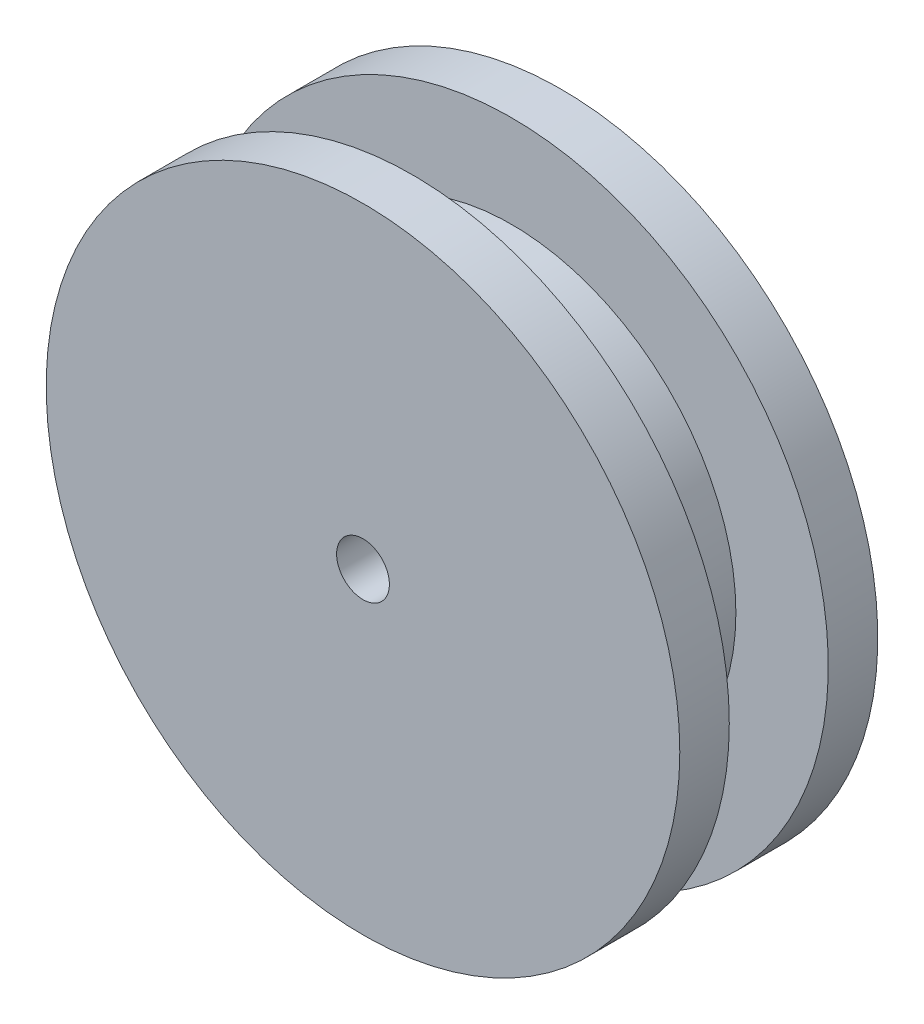
from build123d import *

# Parameters (mm, degrees)
SKETCH1_R           = 34
BOSS_EXTRUDE1_DEPTH = 15
SKETCH2_R           = 48
BOSS_EXTRUDE2_DEPTH = 7.5
BOSS_EXTRUDE3_START = 7.5
SKETCH3_R           = 48
BOSS_EXTRUDE3_DEPTH = 7.5
SKETCH4_R           = 4
CUT_EXTRUDE1_DEPTH  = 30


with BuildPart() as part:
    # Sketch1 → Boss-Extrude1 (new body)
    with BuildSketch(Plane.XY):
        Circle(SKETCH1_R)
    extrude(amount=BOSS_EXTRUDE1_DEPTH)

    # Sketch2 → Boss-Extrude2 (add)
    with BuildSketch(Plane.XY.offset(15)):
        Circle(SKETCH2_R)
    extrude(amount=BOSS_EXTRUDE2_DEPTH)

    # Sketch3 → Boss-Extrude3 (add)
    with BuildSketch(Plane(origin=(0, 0, 0), x_dir=(-1, 0, 0), z_dir=(0, 0, -1)).offset(BOSS_EXTRUDE3_START)):
        with Locations(Location((0, 0, 0), (0, 0, 180))):
            Circle(SKETCH3_R)
    extrude(amount=-BOSS_EXTRUDE3_DEPTH)

    # Sketch4 → Cut-Extrude1 (cut)
    with BuildSketch(Plane(origin=(0, 0, -7.5), x_dir=(-1, 0, 0), z_dir=(0, 0, -1))):
        Circle(SKETCH4_R)
    extrude(amount=-CUT_EXTRUDE1_DEPTH, mode=Mode.SUBTRACT)


solid = part.part
